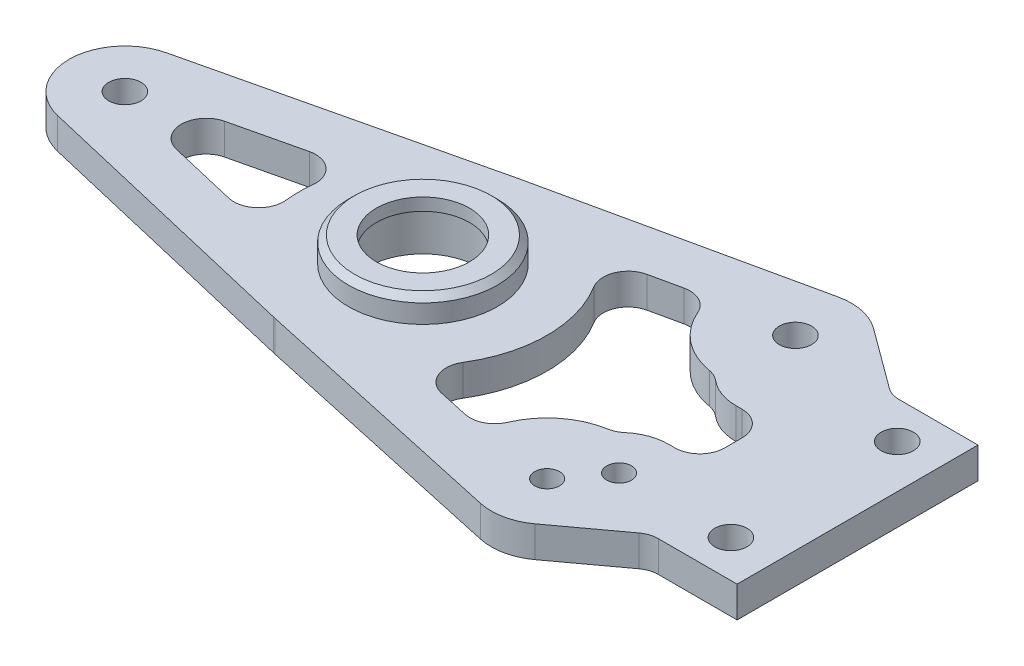
from build123d import *

# Parameters (mm, degrees)
SKETCH1_R           = 1.3
SKETCH1_R_2         = 1
SKETCH1_R_3         = 4.5
BOSS_EXTRUDE1_DEPTH = 2.5
SKETCH3_R           = 6
SKETCH3_R_2         = 3.75
BOSS_EXTRUDE2_DEPTH = 2
SKETCH4_R           = 4.5
SKETCH4_R_2         = 3.75
CUT_EXTRUDE1_DEPTH  = 1
CHAMFER1_SIZE       = 0.5
SKETCH6_R           = 3
CUT_EXTRUDE2_DEPTH  = 0.5


with BuildPart() as part:
    # Sketch1 → Boss-Extrude1 (new body)
    with BuildSketch(Plane(origin=(0, 0, 0), x_dir=(1, 0, 0), z_dir=(0, 1, 0))):
        with BuildLine():
            Line((35, 9.7), (35, -9.7))
            Line((35, -9.7), (28.656580513, -9.7))
            ThreePointArc((28.656580513, -9.7), (28.032756183, -9.799778117), (27.471175871, -10.089156794))
            Line((27.471175871, -10.089156794), (22.667160445, -13.62438739))
            ThreePointArc((22.667160445, -13.62438739), (20.936486005, -14.401466515), (19.039367435, -14.396259626))
            Line((19.039367435, -14.396259626), (-2.134739034, -9.769487666))
            ThreePointArc((-2.134739034, -9.769487666), (-2.213274492, -9.751995489), (-2.291666667, -9.733871989))
            Line((-2.291666667, -9.733871989), (-25.03125, -4.380242395))
            ThreePointArc((-25.03125, -4.380242395), (-28.5, 0), (-25.03125, 4.380242395))
            Line((-25.03125, 4.380242395), (-2.291666667, 9.733871989))
            ThreePointArc((-2.291666667, 9.733871989), (-2.213276651, 9.751994999), (-2.13474336, 9.769486721))
            Line((-2.13474336, 9.769486721), (19.039365488, 14.396269024))
            ThreePointArc((19.039365488, 14.396269024), (20.936487661, 14.401475987), (22.667164776, 13.624394026))
            Line((22.667164776, 13.624394026), (27.47117527, 10.089158211))
            ThreePointArc((27.47117527, 10.089158211), (28.032756372, 9.799778489), (28.656581837, 9.7))
            Line((28.656581837, 9.7), (35, 9.7))
        make_face()
        with Locations((31.5, 6.7)):
            Circle(SKETCH1_R, mode=Mode.SUBTRACT)
        with Locations((31.5, -6.7)):
            Circle(SKETCH1_R, mode=Mode.SUBTRACT)
        with Locations((20, 10)):
            Circle(SKETCH1_R, mode=Mode.SUBTRACT)
        with Locations((20, -9.999990176)):
            Circle(SKETCH1_R_2, mode=Mode.SUBTRACT)
        Circle(SKETCH1_R_3, mode=Mode.SUBTRACT)
        with Locations((-24, 0)):
            Circle(SKETCH1_R, mode=Mode.SUBTRACT)
        with Locations((22.5, -6.7)):
            Circle(SKETCH1_R_2, mode=Mode.SUBTRACT)
        with BuildLine():
            Line((9.772066478, 8.276878442), (12.216286037, 8.810968065))
            ThreePointArc((12.216286037, 8.810968065), (13.559618748, 8.634777191), (14.482426032, 7.642803041))
            ThreePointArc((14.482426032, 7.642803041), (16.274630398, 5.296637232), (18.968838896, 4.089271891))
            ThreePointArc((18.968838896, 4.089271891), (19.472295347, 3.930738723), (19.916745685, 3.646019459))
            ThreePointArc((19.916745685, 3.646019459), (21.124485944, 2.943943413), (22.5, 2.7))
            Line((22.5, 2.7), (23, 2.7))
            ThreePointArc((23, 2.7), (24.414213562, 2.114213562), (25, 0.7))
            Line((25, 0.7), (25, -0.7))
            ThreePointArc((25, -0.7), (24.414213562, -2.114213562), (23, -2.7))
            Line((23, -2.7), (22.5, -2.7))
            ThreePointArc((22.5, -2.7), (21.124485854, -2.943943446), (19.916745538, -3.646019583))
            ThreePointArc((19.916745538, -3.646019583), (19.472295389, -3.930738787), (18.968839153, -4.089271995))
            ThreePointArc((18.968839153, -4.089271995), (16.274635438, -5.296635948), (14.482434575, -7.642798226))
            ThreePointArc((14.482434575, -7.642798226), (13.559627706, -8.634772461), (12.216295281, -8.810963823))
            Line((12.216295281, -8.810963823), (9.772070143, -8.276874115))
            ThreePointArc((9.772070143, -8.276874115), (8.357168863, -7.102458424), (8.499181625, -5.269147152))
            ThreePointArc((8.499181625, -5.269147152), (10, 2.214e-06), (8.499179292, 5.269150915))
            ThreePointArc((8.499179292, 5.269150915), (8.357165718, 7.102462125), (9.772066478, 8.276878442))
        make_face(mode=Mode.SUBTRACT)
        with BuildLine():
            Line((-17.912878788, -1.946774398), (-12.387619024, -3.247598329))
            ThreePointArc((-12.387619024, -3.247598329), (-10.604369925, -2.799022253), (-9.941071409, -1.084019943))
            ThreePointArc((-9.941071409, -1.084019943), (-10, 0), (-9.941071409, 1.084019943))
            ThreePointArc((-9.941071409, 1.084019943), (-10.604369925, 2.799022253), (-12.387619024, 3.247598329))
            Line((-12.387619024, 3.247598329), (-17.912878788, 1.946774398))
            ThreePointArc((-17.912878788, 1.946774398), (-19.454545455, 0), (-17.912878788, -1.946774398))
        make_face(mode=Mode.SUBTRACT)
    extrude(amount=BOSS_EXTRUDE1_DEPTH)

    # Sketch3 → Boss-Extrude2 (add)
    with BuildSketch(Plane(origin=(0, 2.5, 0), x_dir=(1, 0, 0), z_dir=(0, 1, 0))):
        Circle(SKETCH3_R)
        Circle(SKETCH3_R_2, mode=Mode.SUBTRACT)
    extrude(amount=BOSS_EXTRUDE2_DEPTH)

    # Sketch4 → Cut-Extrude1 (cut)
    with BuildSketch(Plane.XZ.offset(-2.5)):
        Circle(SKETCH4_R)
        Circle(SKETCH4_R_2, mode=Mode.SUBTRACT)
    extrude(amount=-CUT_EXTRUDE1_DEPTH, mode=Mode.SUBTRACT)

    # Chamfer1
    chamfer1_edges = [part.edges().sort_by_distance(p)[0] for p in [
        (-6, 4.5, 0),
    ]]
    chamfer(chamfer1_edges, length=CHAMFER1_SIZE)

    # Sketch6 → Cut-Extrude2 (cut)
    with BuildSketch(Plane.XZ):
        with Locations((20, 9.999990176)):
            Circle(SKETCH6_R)
        with Locations((20, -10)):
            Circle(SKETCH6_R)
    extrude(amount=-CUT_EXTRUDE2_DEPTH, mode=Mode.SUBTRACT)


solid = part.part
